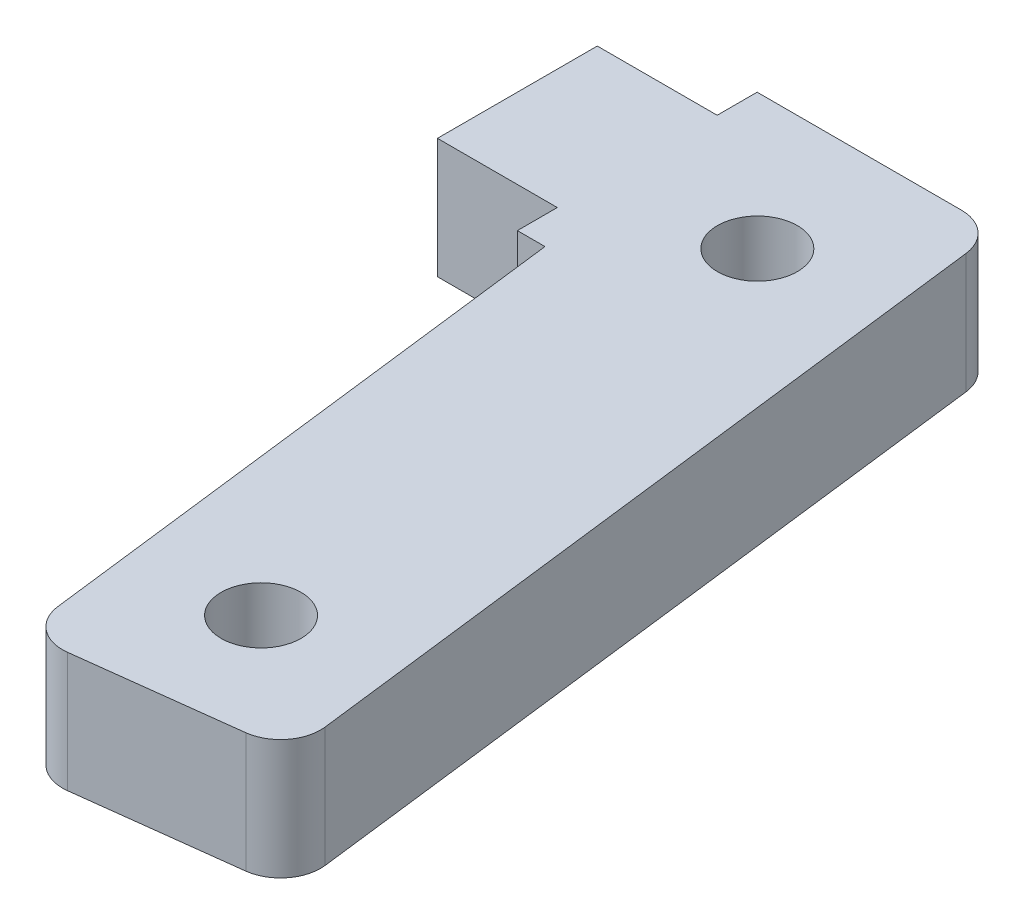
from build123d import *

# Parameters (mm, degrees)
SKETCH2_R           = 1
BOSS_EXTRUDE1_DEPTH = 3
FILLET1_R           = 1


with BuildPart() as part:
    # Sketch2 → Boss-Extrude1 (new body)
    with BuildSketch(Plane(origin=(0, 0, 0), x_dir=(1, 0, 0), z_dir=(0, 1, 0))):
        Polygon((20.748238747, 19.933341623), (14.748238747, 19.933341623), (14.748238747, 18.933341623), (11.748238747, 18.933341623), (11.748238747, 14.933341623), (14.748238747, 14.933341623), (14.748238747, 13.933341623), (15.43988716, 13.933341623), (17.267927311, -0.954850651), (23.22320422, -0.223634591), align=None)
        with Locations(Location((18.141595519, 16.546219938, 0), (0, 0, 270))):
            Circle(SKETCH2_R, mode=Mode.SUBTRACT)
        with Locations(Location((19.879957735, 2.388395834, 0), (0, 0, 270))):
            Circle(SKETCH2_R, mode=Mode.SUBTRACT)
    extrude(amount=BOSS_EXTRUDE1_DEPTH)

    # Fillet1
    fillet1_edges = [part.edges().sort_by_distance(p)[0] for p in [
        (20.748238747, 1.5, -19.933341623),
        (23.22320422, 1.5, 0.223634591),
        (17.267927311, 1.5, 0.954850651),
    ]]
    fillet(fillet1_edges, radius=FILLET1_R)


solid = part.part
